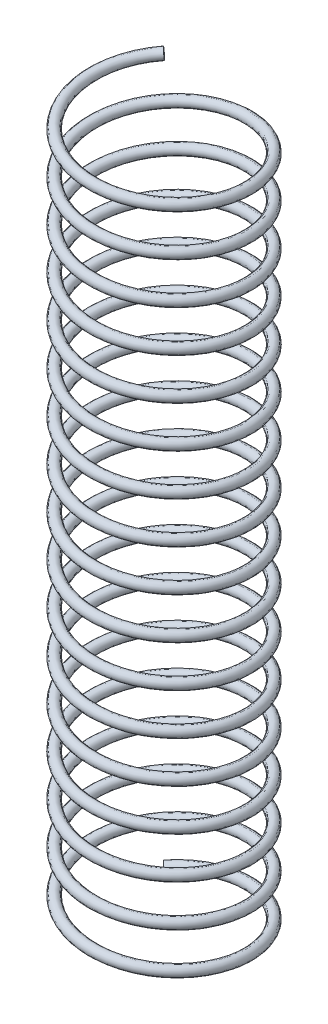
from build123d import *

# Parameters (mm, degrees)
SWEEP_1_PITCH       = 4
SWEEP_1_HEIGHT      = 68
SWEEP_1_RADIUS      = 7.5
SWEEP_1_START_ANGLE = -135
SKETCH_2_R          = 0.5


with BuildPart() as part:
    # 扫描1: sweep along a helix
    with BuildLine() as sweep_1_path:
        add(Helix(SWEEP_1_PITCH, SWEEP_1_HEIGHT, SWEEP_1_RADIUS, center=(0, 0, 0), direction=(0, 1, 0), lefthand=True, mode=Mode.PRIVATE).rotate(Axis((0, 0, 0), (0, 1, 0)), SWEEP_1_START_ANGLE))
    # 草图2 → 扫描1 (sweep)
    with BuildSketch(Plane(origin=(-5.303300859, 0, -5.303300859), x_dir=(-0.6940241385985101, 0.28921640785960134, -0.6593059718123178), z_dir=(0.7045730904631683, 0.08457848656923085, -0.7045730904631816))):
        Circle(SKETCH_2_R)
    sweep(path=sweep_1_path.line, is_frenet=True)


solid = part.part
